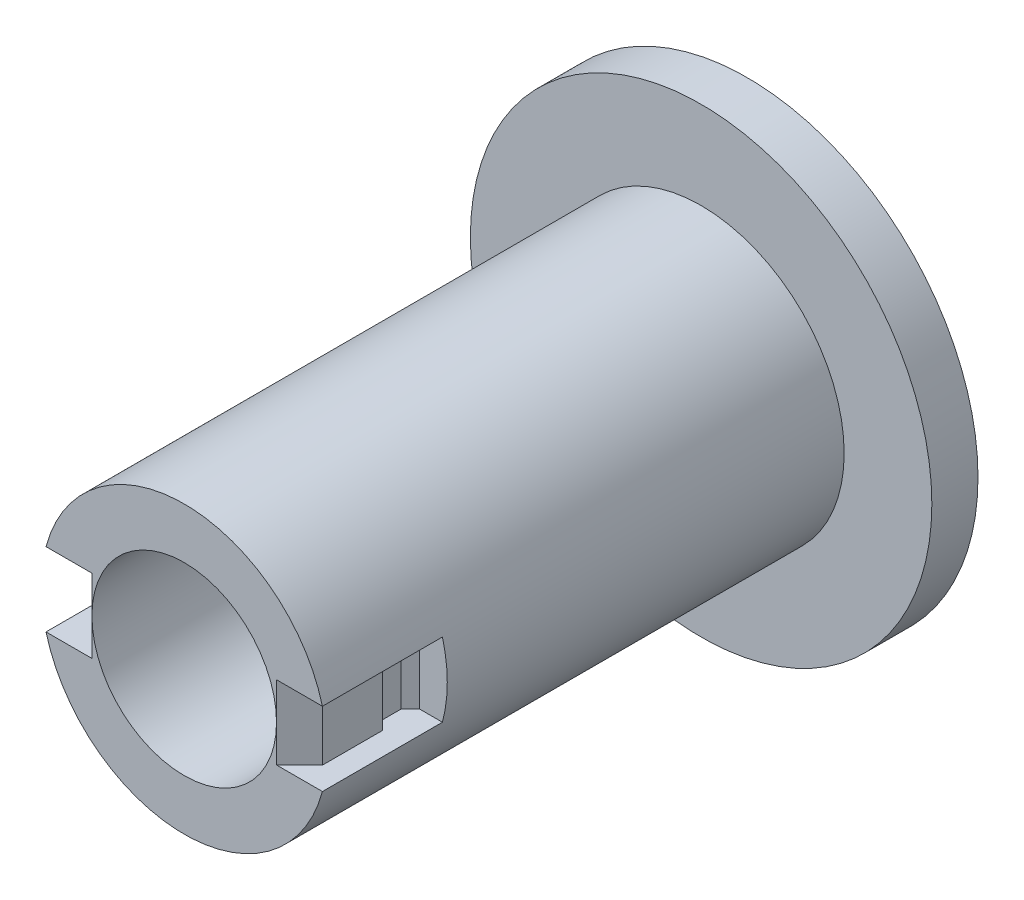
from build123d import *

# Parameters (mm, degrees)
SKETCH1_R           = 15.5
BOSS_EXTRUDE1_DEPTH = 56
SKETCH4_R           = 25
BOSS_EXTRUDE2_DEPTH = 5
SKETCH5_R           = 10
CUT_EXTRUDE1_DEPTH  = 71.505318948
CUT_EXTRUDE2_DEPTH  = 4


with BuildPart() as part:
    # Sketch1 → Boss-Extrude1 (new body)
    with BuildSketch(Plane.XY):
        Circle(SKETCH1_R)
    extrude(amount=BOSS_EXTRUDE1_DEPTH)

    # Sketch4 → Boss-Extrude2 (add)
    with BuildSketch(Plane(origin=(0, 0, 0), x_dir=(-1, 0, 0), z_dir=(0, 0, -1))):
        Circle(SKETCH4_R)
    extrude(amount=BOSS_EXTRUDE2_DEPTH)

    # Sketch5 → Cut-Extrude1 (cut, through all)
    with BuildSketch(Plane.XY.offset(56)):
        Circle(SKETCH5_R)
    extrude(amount=-CUT_EXTRUDE1_DEPTH, mode=Mode.SUBTRACT)

    # Sketch6 → Cut-Extrude2 (cut, symmetric)
    with BuildSketch(Plane(origin=(0, 0, 0), x_dir=(1, 0, 0), z_dir=(0, 1, 0))):
        Polygon((12.5, -53.5), (10, -56), (15.5, -56), (15.5, -43), (12.5, -43), (11.5, -44), (11.5, -46), (12.5, -47), align=None)
    cut_extrude2 = extrude(amount=CUT_EXTRUDE2_DEPTH, both=True, mode=Mode.SUBTRACT)

    # Mirror1: Cut-Extrude2 across plane
    add(cut_extrude2.mirror(Plane(origin=(0, 0, 0), x_dir=(0, 0, 1), z_dir=(1, 0, 0))), mode=Mode.SUBTRACT)


solid = part.part
